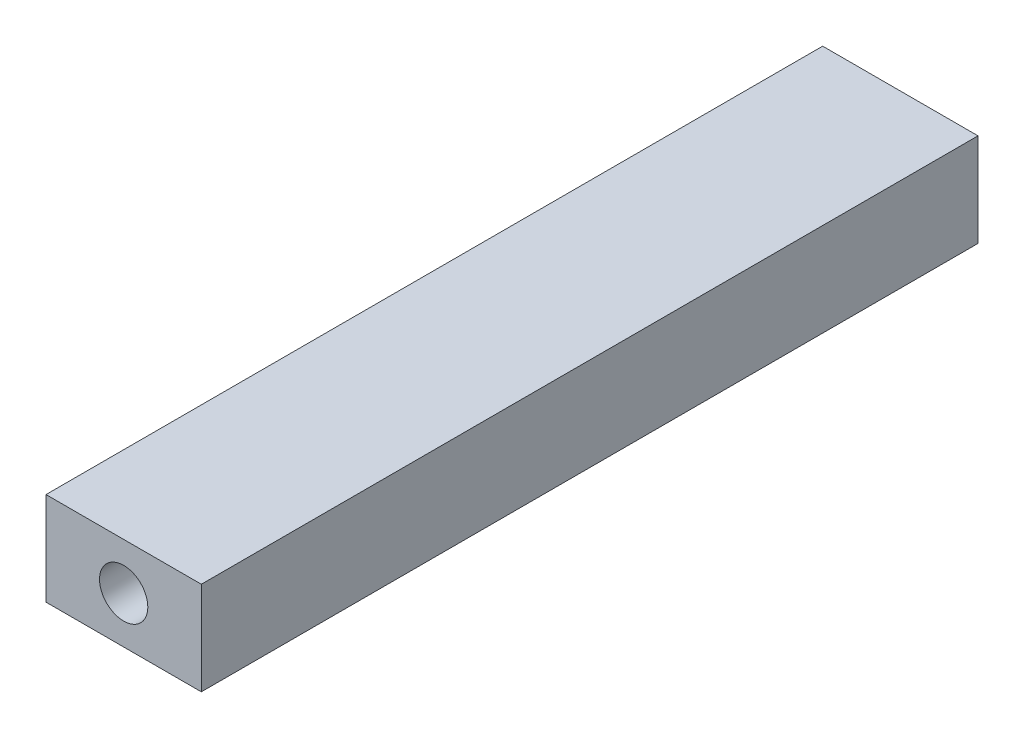
from build123d import *

# Parameters (mm, degrees)
SKETCH3_W           = 100
SKETCH3_H           = 60
SKETCH3_R           = 15.545579394
BOSS_EXTRUDE3_DEPTH = 500


with BuildPart() as part:
    # Sketch3 → Boss-Extrude3 (new body)
    with BuildSketch(Plane.XY):
        with Locations((50, 30)):
            Rectangle(SKETCH3_W, SKETCH3_H)
        with Locations((50, 30)):
            Circle(SKETCH3_R, mode=Mode.SUBTRACT)
    extrude(amount=BOSS_EXTRUDE3_DEPTH)


solid = part.part
